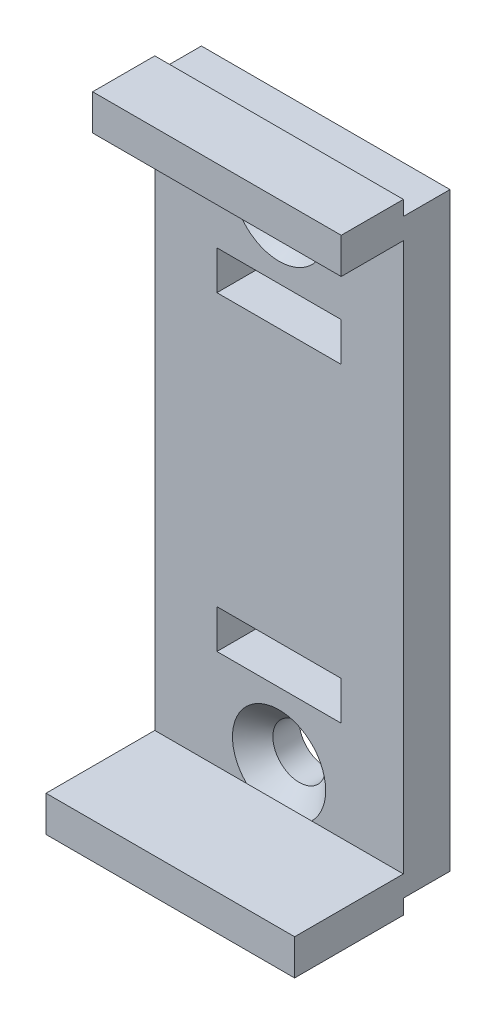
from build123d import *

# Parameters (mm, degrees)
SKETCH_CAMERA_SEAT_W     = 16
SKETCH_CAMERA_SEAT_H     = 38
CAMERA_SEAT_DEPTH        = 3
FRONT_LIP_START          = 3
SKETCH_FRONT_LIP_W       = 16
SKETCH_FRONT_LIP_H       = 2.3
FRONT_LIP_DEPTH          = 7
REAR_LIP_START           = 3
SKETCH_REAR_LIP_W        = 16
SKETCH_REAR_LIP_H        = 2.3
REAR_LIP_DEPTH           = 4
STRAP_SLOTS_START        = -1
SKETCH_STRAP_SLOTS_W     = 8
SKETCH_STRAP_SLOTS_H     = 2.5
STRAP_SLOTS_DEPTH        = 5
M3_THROUGH_START         = -1
SKETCH_M3_THROUGH_R      = 1.7
M3_THROUGH_DEPTH         = 5
FLAT_HEAD_90DEG_START    = 1.5
SKETCH_FLAT_HEAD_90DEG_R = 1.5
FLAT_HEAD_90DEG_DEPTH    = 1.5
FLAT_HEAD_90DEG_TAPER    = -45


with BuildPart() as part:
    # Sketch_Camera_seat → Camera_seat (new body)
    with BuildSketch(Plane.XY):
        Rectangle(SKETCH_CAMERA_SEAT_W, SKETCH_CAMERA_SEAT_H)
    extrude(amount=CAMERA_SEAT_DEPTH)

    # Sketch_Front_lip → Front_lip (add)
    with BuildSketch(Plane.XY.offset(FRONT_LIP_START)):
        with Locations((0, -18.8)):
            Rectangle(SKETCH_FRONT_LIP_W, SKETCH_FRONT_LIP_H)
    extrude(amount=FRONT_LIP_DEPTH)

    # Sketch_Rear_lip → Rear_lip (add)
    with BuildSketch(Plane.XY.offset(REAR_LIP_START)):
        with Locations((0, 18.8)):
            Rectangle(SKETCH_REAR_LIP_W, SKETCH_REAR_LIP_H)
    extrude(amount=REAR_LIP_DEPTH)

    # Sketch_Strap_slots → Strap_slots (cut)
    with BuildSketch(Plane.XY.offset(STRAP_SLOTS_START)):
        with Locations((0, -10)):
            Rectangle(SKETCH_STRAP_SLOTS_W, SKETCH_STRAP_SLOTS_H)
        with Locations((0, 10)):
            Rectangle(SKETCH_STRAP_SLOTS_W, SKETCH_STRAP_SLOTS_H)
    extrude(amount=STRAP_SLOTS_DEPTH, mode=Mode.SUBTRACT)

    # Sketch_M3_through → M3_through (cut)
    with BuildSketch(Plane.XY.offset(M3_THROUGH_START)):
        with Locations((0, -15.5)):
            Circle(SKETCH_M3_THROUGH_R)
        with Locations((0, 15.5)):
            Circle(SKETCH_M3_THROUGH_R)
    extrude(amount=M3_THROUGH_DEPTH, mode=Mode.SUBTRACT)

    # Sketch_Flat_head_90deg → Flat_head_90deg (cut)
    with BuildSketch(Plane.XY.offset(FLAT_HEAD_90DEG_START)):
        with Locations((0, -15.5)):
            Circle(SKETCH_FLAT_HEAD_90DEG_R)
        with Locations((0, 15.5)):
            Circle(SKETCH_FLAT_HEAD_90DEG_R)
    extrude(amount=FLAT_HEAD_90DEG_DEPTH, taper=FLAT_HEAD_90DEG_TAPER, mode=Mode.SUBTRACT)


solid = part.part
